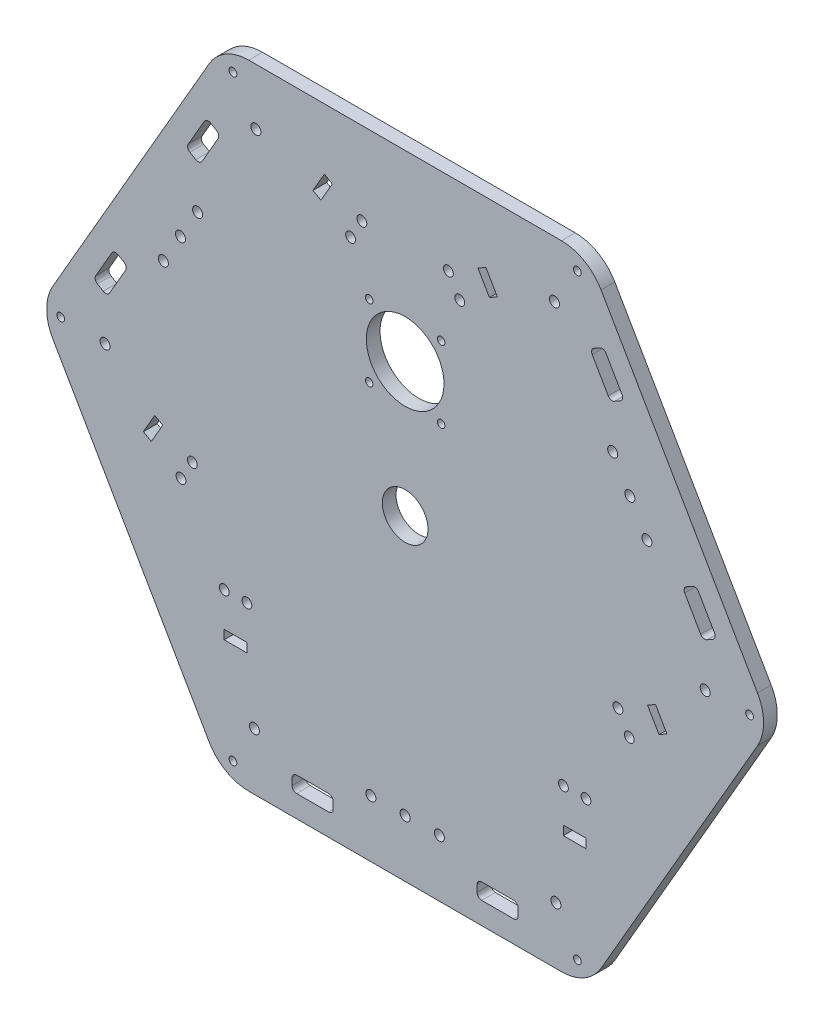
from build123d import *

# Parameters (mm, degrees)
BOSS_EXTRUDE1_DEPTH = 6
FILLET1_R           = 20
SKETCH5_R           = 2.2
CUT_EXTRUDE3_DEPTH  = 10
SKETCH6_W           = 18
SKETCH6_H           = 7
CUT_EXTRUDE4_DEPTH  = 10
FILLET3_R           = 2
SKETCH9_R           = 1.7
CUT_EXTRUDE7_DEPTH  = 70
SKETCH14_R          = 10
CUT_EXTRUDE10_DEPTH = 43
SKETCH15_W          = 10
SKETCH15_H          = 4
CUT_EXTRUDE11_DEPTH = 10
SKETCH16_R          = 1.65
SKETCH16_R_2        = 17
CUT_EXTRUDE12_DEPTH = 10
SKETCH19_R          = 2.2
CUT_EXTRUDE14_DEPTH = 10
SKETCH23_R          = 2.15
CUT_EXTRUDE15_DEPTH = 10


with BuildPart() as part:
    # Sketch1 → Boss-Extrude1 (new body)
    with BuildSketch(Plane.XY):
        Polygon((80, 138.564064606), (-80, 138.564064606), (-160, 0), (-80, -138.564064606), (80, -138.564064606), (160, 0), align=None)
    extrude(amount=BOSS_EXTRUDE1_DEPTH)

    # Fillet1
    fillet1_edges = [part.edges().sort_by_distance(p)[0] for p in [
        (160, 0, 3),
        (80, -138.564064606, 3),
        (-80, -138.564064606, 3),
        (-160, 0, 3),
        (-80, 138.564064606, 3),
        (80, 138.564064606, 3),
    ]]
    fillet(fillet1_edges, radius=FILLET1_R)

    # Sketch5 → Cut-Extrude3 (cut)
    with BuildSketch(Plane.XY.offset(6)):
        with Locations((-66, -113.564064606)):
            Circle(SKETCH5_R)
        with Locations((-15, -113.564064606)):
            Circle(SKETCH5_R)
        with Locations((15, -113.564064606)):
            Circle(SKETCH5_R)
        with Locations((66, -113.564064606)):
            Circle(SKETCH5_R)
        with Locations((-65.349364905, 113.939708953)):
            Circle(SKETCH5_R)
        with Locations((-90.849364905, 69.77241336)):
            Circle(SKETCH5_R)
        with Locations((-105.849364905, 43.791651246)):
            Circle(SKETCH5_R)
        with Locations((-131.349364905, -0.375644347)):
            Circle(SKETCH5_R)
        with Locations((131.349364905, -0.375644347)):
            Circle(SKETCH5_R)
        with Locations((105.849364905, 43.791651246)):
            Circle(SKETCH5_R)
        with Locations((90.849364905, 69.77241336)):
            Circle(SKETCH5_R)
        with Locations((65.349364905, 113.939708953)):
            Circle(SKETCH5_R)
    extrude(amount=-CUT_EXTRUDE3_DEPTH, mode=Mode.SUBTRACT)

    # Sketch6 → Cut-Extrude4 (cut)
    with BuildSketch(Plane.XY.offset(6)):
        with Locations((-40.5, -125.464064606)):
            Rectangle(SKETCH6_W, SKETCH6_H)
        with Locations((40.5, -125.464064606)):
            Rectangle(SKETCH6_W, SKETCH6_H)
        Polygon((-86.936156124, 107.35028979), (-95.936156124, 91.761832522), (-89.873978297, 88.261832522), (-80.873978297, 103.85028979), align=None)
        Polygon((-127.436156124, 37.202232084), (-121.373978297, 33.702232084), (-130.373978297, 18.113774815), (-136.436156124, 21.613774815), align=None)
        Polygon((136.436156124, 21.613774815), (127.436156124, 37.202232084), (121.373978297, 33.702232084), (130.373978297, 18.113774815), align=None)
        Polygon((95.936156124, 91.761832522), (89.873978297, 88.261832522), (80.873978297, 103.85028979), (86.936156124, 107.35028979), align=None)
    extrude(amount=-CUT_EXTRUDE4_DEPTH, mode=Mode.SUBTRACT)

    # Fillet3
    fillet3_edges = [part.edges().sort_by_distance(p)[0] for p in [
        (121.373978297, 33.702232084, 3),
        (127.436156124, 37.202232084, 3),
        (136.436156124, 21.613774815, 3),
        (130.373978297, 18.113774815, 3),
        (-130.373978297, 18.113774815, 3),
        (-136.436156124, 21.613774815, 3),
        (-127.436156124, 37.202232084, 3),
        (-121.373978297, 33.702232084, 3),
        (-89.873978297, 88.261832522, 3),
        (-95.936156124, 91.761832522, 3),
        (-86.936156124, 107.35028979, 3),
        (-80.873978297, 103.85028979, 3),
        (49.5, -121.964064606, 3),
        (49.5, -128.964064606, 3),
        (31.5, -128.964064606, 3),
        (31.5, -121.964064606, 3),
        (80.873978297, 103.85028979, 3),
        (86.936156124, 107.35028979, 3),
        (95.936156124, 91.761832522, 3),
        (89.873978297, 88.261832522, 3),
        (-31.5, -121.964064606, 3),
        (-31.5, -128.964064606, 3),
        (-49.5, -128.964064606, 3),
        (-49.5, -121.964064606, 3),
    ]]
    fillet(fillet3_edges, radius=FILLET3_R)

    # Sketch9 → Cut-Extrude7 (cut)
    with BuildSketch(Plane.XY.offset(6)):
        with Locations((-75.381197846, -130.564064606)):
            Circle(SKETCH9_R)
        with Locations((75.381197846, -130.564064606)):
            Circle(SKETCH9_R)
        with Locations((-75.381197846, 130.564064606)):
            Circle(SKETCH9_R)
        with Locations((-150.762395693, 0)):
            Circle(SKETCH9_R)
        with Locations((150.762395693, 0)):
            Circle(SKETCH9_R)
        with Locations((75.381197846, 130.564064606)):
            Circle(SKETCH9_R)
    extrude(amount=-CUT_EXTRUDE7_DEPTH, mode=Mode.SUBTRACT)

    # Sketch14 → Cut-Extrude10 (cut)
    with BuildSketch(Plane.XY.offset(6)):
        Circle(SKETCH14_R)
    extrude(amount=-CUT_EXTRUDE10_DEPTH, mode=Mode.SUBTRACT)

    # Sketch15 → Cut-Extrude11 (cut)
    with BuildSketch(Plane.XY.offset(6)):
        Polygon((-109.579927657, -16.669872981), (-106.115826042, -18.669872981), (-111.115826042, -27.330127019), (-114.579927657, -25.330127019), align=None)
        Polygon((-35.353430349, 111.894191624), (-40.353430349, 103.233937587), (-36.889328734, 101.233937587), (-31.889328734, 109.894191624), align=None)
        Polygon((40.353430349, 103.233937587), (36.889328734, 101.233937587), (31.889328734, 109.894191624), (35.353430349, 111.894191624), align=None)
        Polygon((114.579927657, -25.330127019), (109.579927657, -16.669872981), (106.115826042, -18.669872981), (111.115826042, -27.330127019), align=None)
        with Locations((74.226497308, -84.564064606)):
            Rectangle(SKETCH15_W, SKETCH15_H)
        with Locations((-74.226497308, -84.564064606)):
            Rectangle(SKETCH15_W, SKETCH15_H)
    extrude(amount=-CUT_EXTRUDE11_DEPTH, mode=Mode.SUBTRACT)

    # Sketch16 → Cut-Extrude12 (cut)
    with BuildSketch(Plane.XY.offset(6)):
        with Locations((15.75, 74.314064606)):
            Circle(SKETCH16_R)
        with Locations((-15.75, 74.314064606)):
            Circle(SKETCH16_R)
        with Locations((15.75, 42.814064606)):
            Circle(SKETCH16_R)
        with Locations((-15.75, 42.814064606)):
            Circle(SKETCH16_R)
        with Locations((0, 58.564064606)):
            Circle(SKETCH16_R_2)
    extrude(amount=-CUT_EXTRUDE12_DEPTH, mode=Mode.SUBTRACT)

    # Sketch19 → Cut-Extrude14 (cut)
    with BuildSketch(Plane.XY.offset(6)):
        with Locations((-98.349364905, 56.782032303)):
            Circle(SKETCH19_R)
        with Locations((98.349364905, 56.782032303)):
            Circle(SKETCH19_R)
        with Locations((0, -113.564064606)):
            Circle(SKETCH19_R)
    extrude(amount=-CUT_EXTRUDE14_DEPTH, mode=Mode.SUBTRACT)

    # Sketch23 → Cut-Extrude15 (cut)
    with BuildSketch(Plane.XY.offset(6)):
        with Locations((79.176497308, -67.564064606)):
            Circle(SKETCH23_R)
        with Locations((69.276497308, -67.564064606)):
            Circle(SKETCH23_R)
        with Locations((-69.276497308, -67.564064606)):
            Circle(SKETCH23_R)
        with Locations((-79.176497308, -67.564064606)):
            Circle(SKETCH23_R)
        with Locations((-98.100444985, -34.786825749)):
            Circle(SKETCH23_R)
        with Locations((-93.150444985, -26.213174251)):
            Circle(SKETCH23_R)
        with Locations((-23.873947677, 93.777238857)):
            Circle(SKETCH23_R)
        with Locations((-18.923947677, 102.350890354)):
            Circle(SKETCH23_R)
        with Locations((18.923947677, 102.350890354)):
            Circle(SKETCH23_R)
        with Locations((23.873947677, 93.777238857)):
            Circle(SKETCH23_R)
        with Locations((93.150444985, -26.213174251)):
            Circle(SKETCH23_R)
        with Locations((98.100444985, -34.786825749)):
            Circle(SKETCH23_R)
    extrude(amount=-CUT_EXTRUDE15_DEPTH, mode=Mode.SUBTRACT)


solid = part.part
